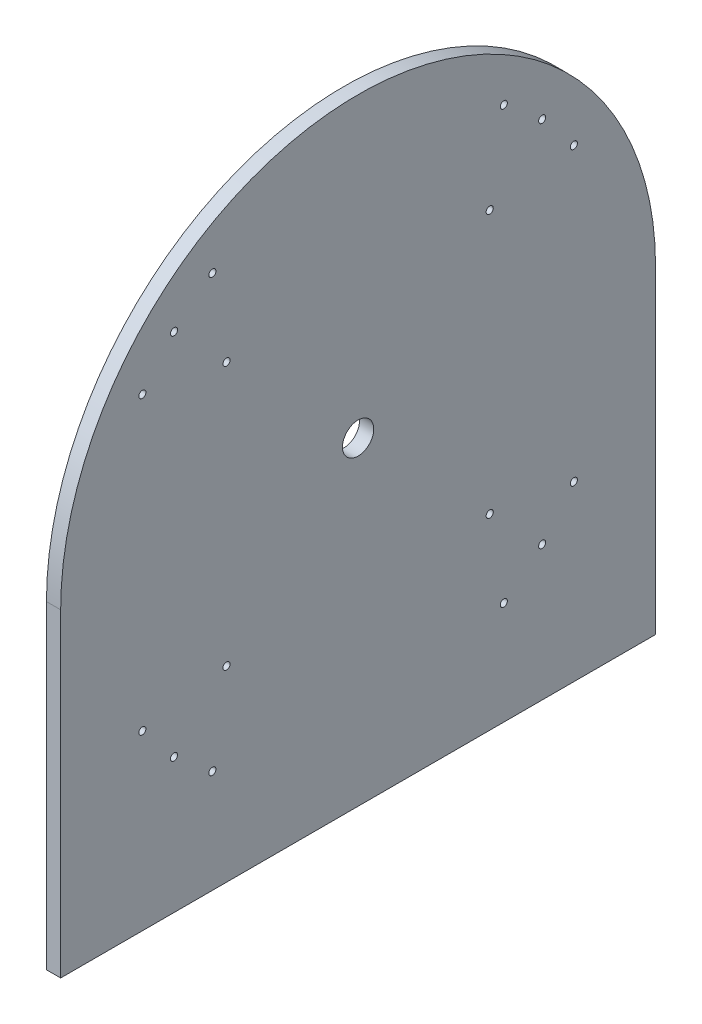
from build123d import *

# Parameters (mm, degrees)
BOSS_EXTRUDE1_DEPTH = 10
SKETCH2_R           = 2.5
CUT_EXTRUDE1_DEPTH  = 10
SKETCH3_R           = 11
CUT_EXTRUDE2_DEPTH  = 10
SKETCH4_R           = 2.5
CUT_EXTRUDE3_DEPTH  = 10


with BuildPart() as part:
    # Sketch1 → Boss-Extrude1 (new body)
    with BuildSketch(Plane(origin=(0, 0, 0), x_dir=(0, 0, -1), z_dir=(1, 0, 0))):
        with BuildLine():
            ThreePointArc((-209.31, 0), (0, -209.31), (209.31, 0))
            Line((209.31, 0), (-209.31, 0))
        make_face()
        with BuildLine():
            Line((-209.31, 0), (209.31, 0))
            ThreePointArc((209.31, 0), (0, 209.31), (-209.31, 0))
        make_face()
        with BuildLine():
            Line((-209.31, -224.4), (209.31, -224.4))
            Line((209.31, -224.4), (209.31, 0))
            ThreePointArc((209.31, 0), (0, -209.31), (-209.31, 0))
            Line((-209.31, 0), (-209.31, -224.4))
        make_face()
    extrude(amount=BOSS_EXTRUDE1_DEPTH)

    # Sketch2 → Cut-Extrude1 (cut)
    with BuildSketch(Plane(origin=(10, 0, 0), x_dir=(0, 0, -1), z_dir=(1, 0, 0))):
        with Locations((129.534891246, 129.534891246)):
            Circle(SKETCH2_R)
        with Locations((92.609775132, 92.609775132)):
            Circle(SKETCH2_R)
        with Locations((92.609775132, -92.609775132)):
            Circle(SKETCH2_R)
        with Locations((129.534891246, -129.534891246)):
            Circle(SKETCH2_R)
        with Locations((-92.609775132, -92.609775132)):
            Circle(SKETCH2_R)
        with Locations((-129.534891246, -129.534891246)):
            Circle(SKETCH2_R)
        with Locations((-92.609775132, 92.609775132)):
            Circle(SKETCH2_R)
        with Locations((-129.534891246, 129.534891246)):
            Circle(SKETCH2_R)
    extrude(amount=-CUT_EXTRUDE1_DEPTH, mode=Mode.SUBTRACT)

    # Sketch3 → Cut-Extrude2 (cut)
    with BuildSketch(Plane(origin=(10, 0, 0), x_dir=(0, 0, -1), z_dir=(1, 0, 0))):
        Circle(SKETCH3_R)
    extrude(amount=-CUT_EXTRUDE2_DEPTH, mode=Mode.SUBTRACT)

    # Sketch4 → Cut-Extrude3 (cut)
    with BuildSketch(Plane(origin=(10, 0, 0), x_dir=(0, 0, -1), z_dir=(1, 0, 0))):
        with Locations((-151.806215462, 102.53511129)):
            Circle(SKETCH4_R)
        with Locations(Location((-102.53511129, 151.806215462, 0), (0, 0, 180))):
            Circle(SKETCH4_R)
        with Locations((102.53511129, 151.806215462)):
            Circle(SKETCH4_R)
        with Locations(Location((151.806215462, 102.53511129, 0), (0, 0, 180))):
            Circle(SKETCH4_R)
        with Locations((151.806215462, -102.53511129)):
            Circle(SKETCH4_R)
        with Locations(Location((102.53511129, -151.806215462, 0), (0, 0, 180))):
            Circle(SKETCH4_R)
        with Locations((-102.53511129, -151.806215462)):
            Circle(SKETCH4_R)
        with Locations(Location((-151.806215462, -102.53511129, 0), (0, 0, 180))):
            Circle(SKETCH4_R)
    extrude(amount=-CUT_EXTRUDE3_DEPTH, mode=Mode.SUBTRACT)


solid = part.part
